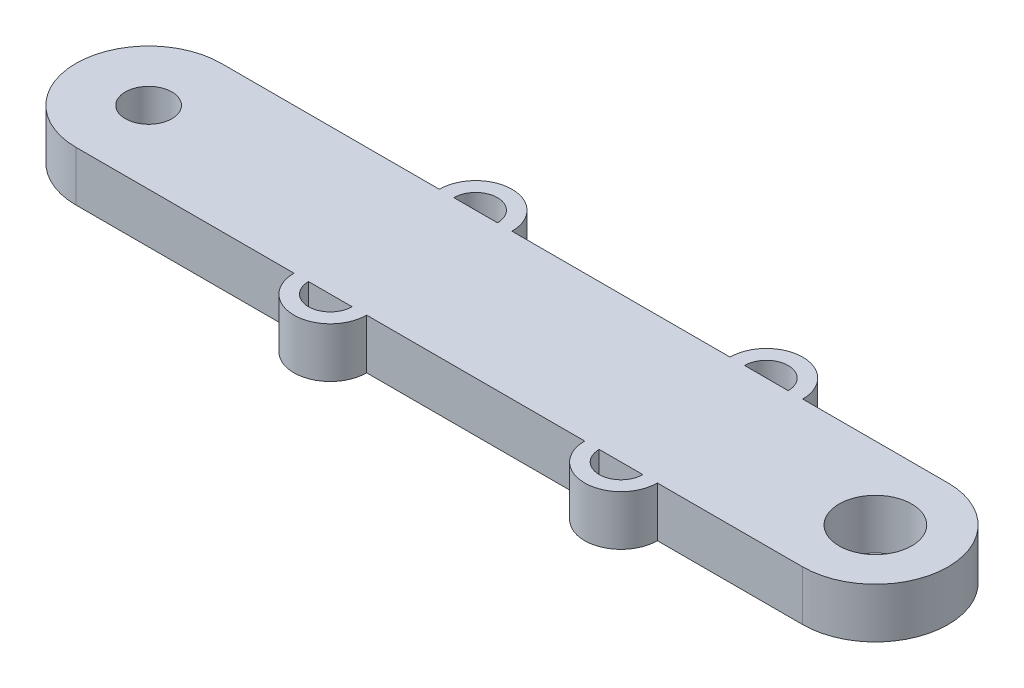
from build123d import *

# Parameters (mm, degrees)
CROQUIS1_R              = 3.2
CROQUIS1_R_2            = 5
SALIENTE_EXTRUIR2_DEPTH = 6.88
SALIENTE_EXTRUIR3_DEPTH = 6.88
MATRIZL1_COUNT          = 2
MATRIZL1_PITCH          = 40
SIMETR_A1_COPY_1_DEPTH  = 6.88


with BuildPart() as part:
    # Croquis1 → Saliente-Extruir2 (new body)
    with BuildSketch(Plane(origin=(0, 0, 0), x_dir=(1, 0, 0), z_dir=(0, 1, 0))):
        with BuildLine():
            Line((-50, -10), (50, -10))
            ThreePointArc((50, -10), (60, 0), (50, 10))
            Line((50, 10), (-50, 10))
            ThreePointArc((-50, 10), (-60, 0), (-50, -10))
        make_face()
        with Locations(Location((-50, 0, 0), (0, 0, 270))):
            Circle(CROQUIS1_R, mode=Mode.SUBTRACT)
        with Locations(Location((50, 0, 0), (0, 0, 270))):
            Circle(CROQUIS1_R_2, mode=Mode.SUBTRACT)
    extrude(amount=SALIENTE_EXTRUIR2_DEPTH)

    # Croquis3 → Saliente-Extruir3 (add)
    with BuildSketch(Plane(origin=(0, 0, 0), x_dir=(1, 0, 0), z_dir=(0, 1, 0))):
        with BuildLine():
            Line((-20, -10), (-18, -10))
            ThreePointArc((-18, -10), (-15, -13), (-12, -10))
            Line((-12, -10), (-10, -10))
            ThreePointArc((-10, -10), (-15, -15), (-20, -10))
        make_face()
    saliente_extruir3 = extrude(amount=SALIENTE_EXTRUIR3_DEPTH)

    # MatrizL1: Saliente-Extruir3 ×2
    with Locations(*[(i * MATRIZL1_PITCH, 0, 0) for i in range(1, MATRIZL1_COUNT)]):
        add(saliente_extruir3)

    # Simetría1: Saliente-Extruir3 across plane
    add(saliente_extruir3.mirror(Plane.XY))

    # Simetría1 copy 1 sketch → Simetría1 copy 1 (add)
    with BuildSketch(Plane(origin=(40, 0, 0), x_dir=(1, 0, 0), z_dir=(0, 1, 0))):
        with BuildLine():
            Line((-20, 10), (-18, 10))
            ThreePointArc((-18, 10), (-15, 13), (-12, 10))
            Line((-12, 10), (-10, 10))
            ThreePointArc((-10, 10), (-15, 15), (-20, 10))
        make_face()
    extrude(amount=SIMETR_A1_COPY_1_DEPTH)


solid = part.part
